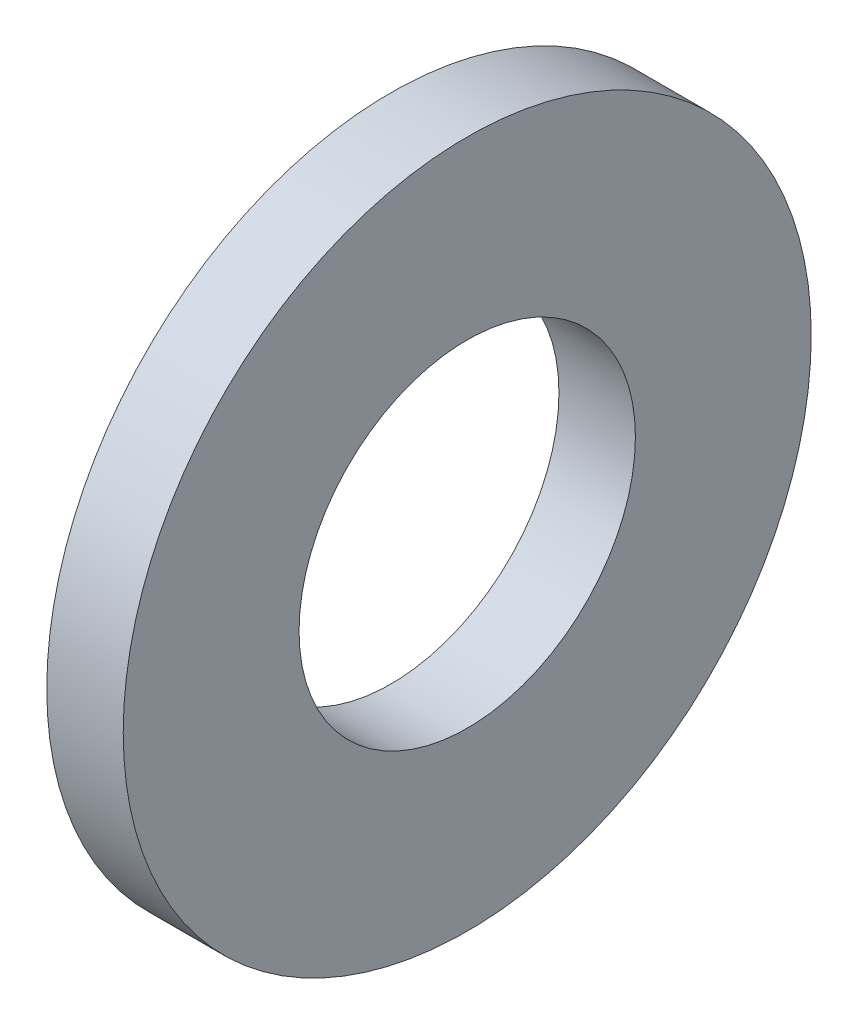
from build123d import *

# Parameters (mm, degrees)
SKETCH1_R          = 9
SKETCH1_R_2        = 4.4
BASE_EXTRUDE_DEPTH = 2


with BuildPart() as part:
    # Sketch1 → Base-Extrude (new body)
    with BuildSketch(Plane(origin=(0, 0, 0), x_dir=(0, 0, -1), z_dir=(1, 0, 0))):
        Circle(SKETCH1_R)
        Circle(SKETCH1_R_2, mode=Mode.SUBTRACT)
    extrude(amount=BASE_EXTRUDE_DEPTH)


solid = part.part
